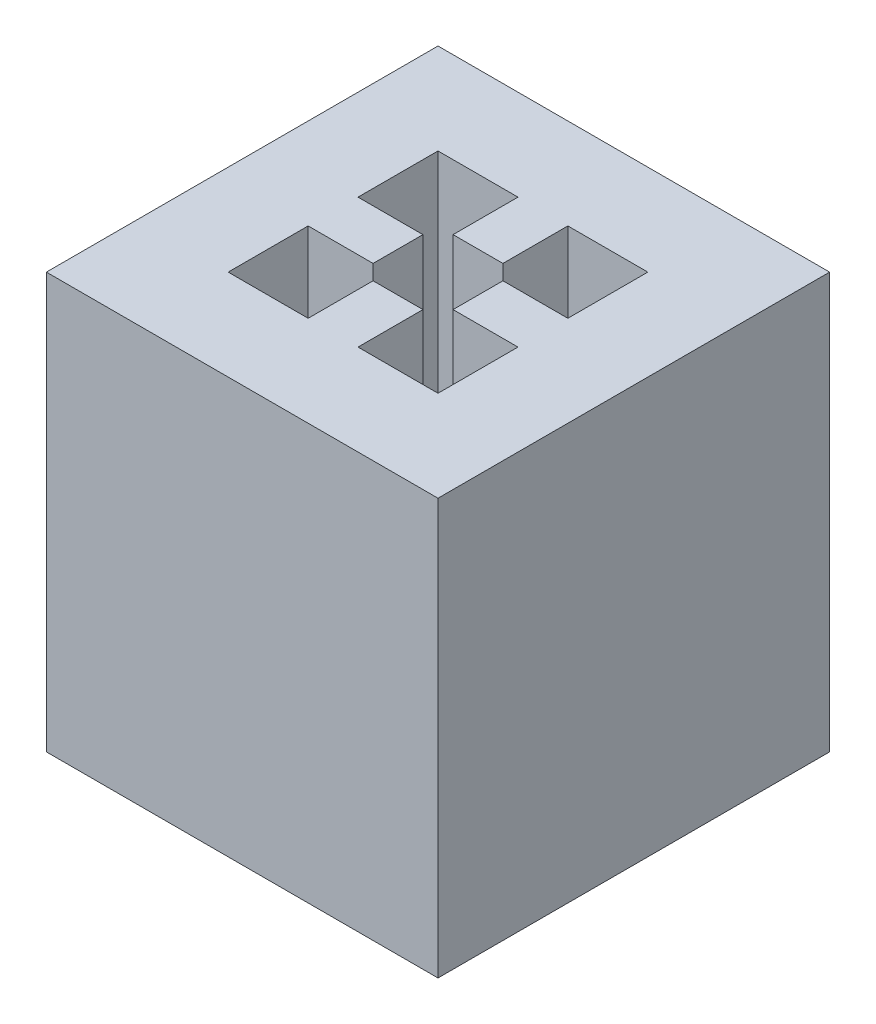
from build123d import *

# Parameters (mm, degrees)
ESQUISSE1_W        = 37.7
ESQUISSE1_H        = 37.7
BOSS_EXTRU_1_DEPTH = 40


with BuildPart() as part:
    # Esquisse1 → Boss.-Extru.1 (new body)
    with BuildSketch(Plane(origin=(0, 0, 0), x_dir=(1, 0, 0), z_dir=(0, 1, 0))):
        Rectangle(ESQUISSE1_W, ESQUISSE1_H)
        Polygon((-10.1, 10.1), (-2.4, 10.1), (-2.4, 3.85), (2.4, 3.85), (2.4, 10.1), (10.1, 10.1), (10.1, 2.4), (3.85, 2.4), (3.85, -2.4), (10.1, -2.4), (10.1, -10.1), (2.4, -10.1), (2.4, -3.85), (-2.4, -3.85), (-2.4, -10.1), (-10.1, -10.1), (-10.1, -2.4), (-3.85, -2.4), (-3.85, 2.4), (-10.1, 2.4), align=None, mode=Mode.SUBTRACT)
    boss_extru_1 = extrude(amount=BOSS_EXTRU_1_DEPTH)


with BuildPart() as sym_trie1_1:
    # Symétrie1: Boss.-Extru.1 across plane
    add(boss_extru_1.mirror(Plane.XY))


with BuildPart() as part_1:
    add(part.part)

    # Symétrie1 united with what the copies to: union Symétrie1_1
    add(sym_trie1_1.part)


solid = part_1.part
